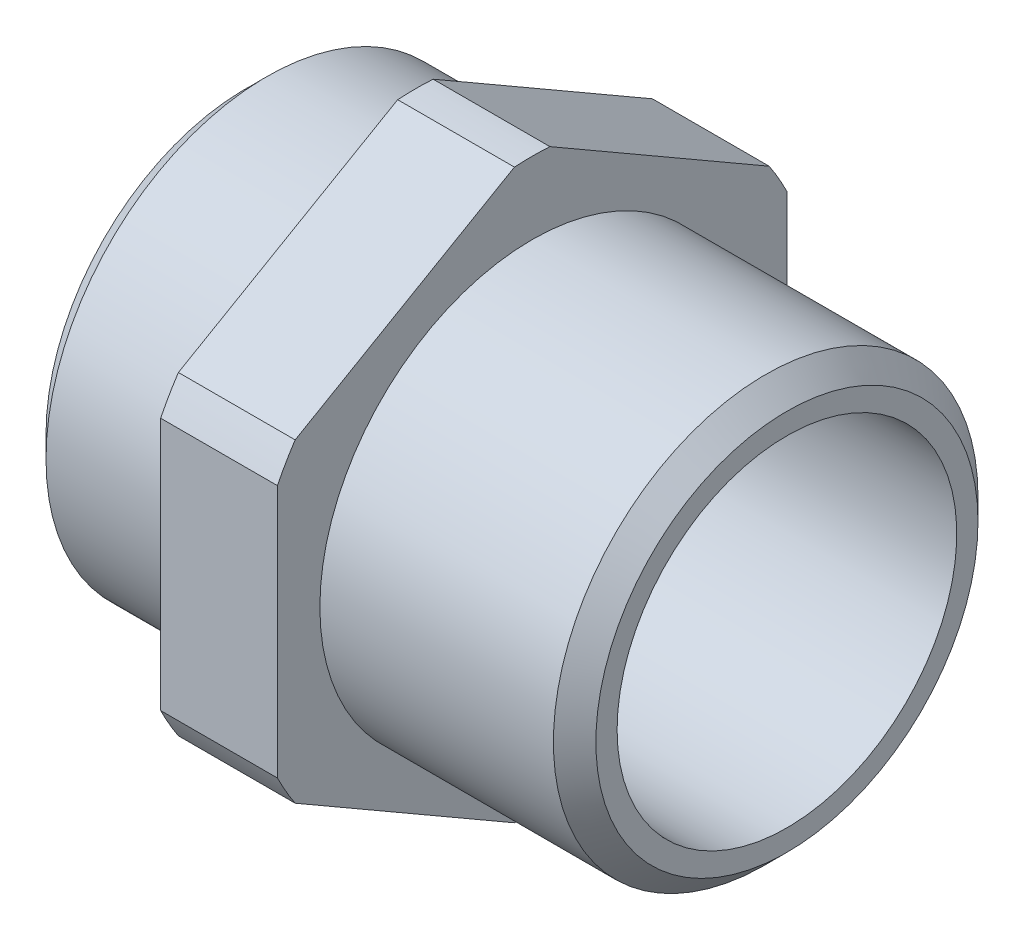
from build123d import *

# Parameters (mm, degrees)
SKETCH_2_R               = 10
EXTRUDE_1_DEPTH          = 12
SKETCH_3_R               = 10
EXTRUDE_2_DEPTH          = 5.5
SKETCH_4_R               = 10.4
EXTRUDE_3_DEPTH          = 8
SKETCH_6_R               = 13.856406461
SKETCH_6_R_2             = 13.4
CUT_EXTRUDE_1_DEPTH      = 26.342651795
CHAMFER_1_SIZE           = 1
EXTRUDE_4_REACH          = 26.545
SKETCH_7_W               = 1
SKETCH_7_H               = 8.5
SKETCH_8_R               = 7
CUT_EXTRUDE_2_DEPTH      = 32.205928924
SKETCH_9_R               = 8.5
CUT_EXTRUDE_3_DEPTH      = 6.5
PATTERN_CIRCULAR_1_COUNT = 6


with BuildPart() as part:
    # Эскиз2 → Вытянуть1 (new body)
    with BuildSketch(Plane(origin=(0, 0, 0), x_dir=(0, 0, -1), z_dir=(1, 0, 0))):
        Circle(SKETCH_2_R)
    extrude(amount=-EXTRUDE_1_DEPTH)

    # Эскиз3 → Вытянуть2 (add)
    # profile 1 of 2: a face of its own
    with BuildSketch(Plane.ZY.offset(12)):
        Polygon((12, -6.92820323), (12, 6.92820323), (0, 13.856406461), (-12, 6.92820323), (-12, -6.92820323), (0, -13.856406461), align=None)
        with Locations(Location((0, 0, 0), (0, 0, 180))):
            Circle(SKETCH_3_R, mode=Mode.SUBTRACT)
    # profile 2 of 2: a face of its own
    with BuildSketch(Plane.ZY.offset(12)):
        with Locations(Location((0, 0, 0), (0, 0, 180))):
            Circle(SKETCH_3_R)
    extrude(amount=EXTRUDE_2_DEPTH)

    # Эскиз4 → Вытянуть3 (add)
    with BuildSketch(Plane.ZY.offset(17.5)):
        Circle(SKETCH_4_R)
    extrude(amount=EXTRUDE_3_DEPTH)

    # Эскиз5 → Вырез-Повернуть1 (revolve, cut)
    with BuildSketch(Plane.XY, mode=Mode.PRIVATE) as cut_revolve_1_sk:
        Polygon((0, 0), (0, 8), (-16.7, 8), (-16.7, 7), (-17.5, 7), (-19, 8.5), (-25.5, 8.5), (-25.5, 0), align=None)
    revolve(cut_revolve_1_sk.sketch.rotate(Axis((-25.5, 0, 0), (1, 0, 0)), 90), axis=Axis((-25.5, 0, 0), (1, 0, 0)), mode=Mode.SUBTRACT)

    # Эскиз6 → Вырез-Вытянуть1 (cut, through all)
    with BuildSketch(Plane.ZY.offset(17.5)):
        Circle(SKETCH_6_R)
        Circle(SKETCH_6_R_2, mode=Mode.SUBTRACT)
    extrude(amount=-CUT_EXTRUDE_1_DEPTH, mode=Mode.SUBTRACT)

    # Фаска1
    chamfer_1_edges = [part.edges().sort_by_distance(p)[0] for p in [
        (0, 0, 10),
        (-25.5, 0, -10.4),
    ]]
    chamfer(chamfer_1_edges, length=CHAMFER_1_SIZE)

    # Вытянуть4: up to this face of the body (flat: up to its plane)
    extrude_4_end = Plane(part.part.faces().sort_by_distance((-25.5, 0, -9.13412785))[0])
    # Эскиз7 → Вытянуть4 (add, up to the picked face)
    with BuildSketch(Plane(origin=(-16.7, 0, 0), x_dir=(0, 0, -1), z_dir=(1, 0, 0)), mode=Mode.PRIVATE) as extrude_4_sk1:
        with Locations((0, 4.25)):
            Rectangle(SKETCH_7_W, SKETCH_7_H)
    extrude_4_tool1 = split(extrude(extrude_4_sk1.sketch, amount=-EXTRUDE_4_REACH, mode=Mode.PRIVATE), bisect_by=extrude_4_end, keep=Keep.BOTH, mode=Mode.PRIVATE)
    add(extrude_4_tool1.solids().sort_by(Axis((-16.7, 4.25, 0), (-1, 0, 0)))[0])

    # Эскиз8 → Вырез-Вытянуть2 (cut, through all)
    with BuildSketch(Plane.ZY.offset(25.5)):
        Circle(SKETCH_8_R)
    extrude(amount=-CUT_EXTRUDE_2_DEPTH, mode=Mode.SUBTRACT)

    # Эскиз9 → Вырез-Вытянуть3 (cut)
    with BuildSketch(Plane.ZY.offset(25.5)):
        Circle(SKETCH_9_R)
    extrude(amount=-CUT_EXTRUDE_3_DEPTH, mode=Mode.SUBTRACT)

    # Круговой массив1: part ×6 about axis
    pattern_circular_1_axis = Axis((0, 0, 0), (1, 0, 0))


with BuildPart() as part_1:
    add(part.part)
    for i in range(1, PATTERN_CIRCULAR_1_COUNT):
        add(part.part.rotate(pattern_circular_1_axis, i * 360 / PATTERN_CIRCULAR_1_COUNT))


solid = part_1.part
